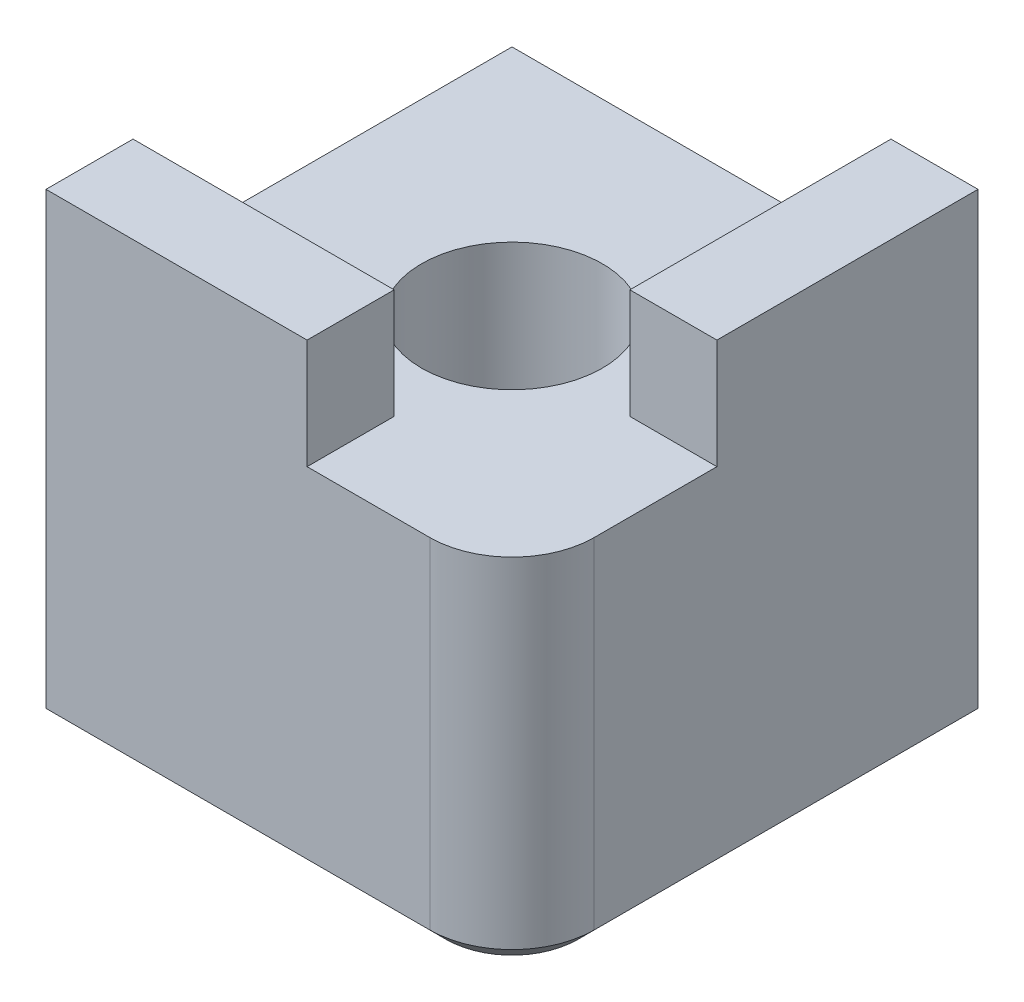
from build123d import *

# Parameters (mm, degrees)
BASE_W              = 8.5
BASE_H              = 8.5
BOSS_EXTRUDE1_DEPTH = 8
CUTOUT_W            = 7
CUTOUT_H            = 7
CUT_EXTRUDE1_DEPTH  = 1.5
SKETCH3_W           = 1.5
SKETCH3_H           = 1.5
CUT_EXTRUDE2_DEPTH  = 12.448253142
FILLET3_R           = 0.508
FILLET4_R           = 1.5
M4_TAPPED_HOLE1_D   = 3.3
CHAMFER1_SIZE       = 0.3
CUT_EXTRUDE3_START  = -1.5
CUT_EXTRUDE3_DEPTH  = 1.5
SKETCH16_W          = 1.5875
SKETCH16_H          = 4.7625
SKETCH16_W_2        = 4.7625
SKETCH16_H_2        = 1.5875
BOSS_EXTRUDE2_DEPTH = 2


with BuildPart() as part:
    # Base → Boss-Extrude1 (new body)
    with BuildSketch(Plane(origin=(0, 0, 0), x_dir=(1, 0, 0), z_dir=(0, 1, 0))):
        Rectangle(BASE_W, BASE_H)
    extrude(amount=-BOSS_EXTRUDE1_DEPTH)

    # Cutout → Cut-Extrude1 (cut)
    with BuildSketch(Plane(origin=(0, 0, 0), x_dir=(1, 0, 0), z_dir=(0, 1, 0))):
        with Locations((-0.75, 0.75)):
            Rectangle(CUTOUT_W, CUTOUT_H)
    extrude(amount=-CUT_EXTRUDE1_DEPTH, mode=Mode.SUBTRACT)

    # Sketch3 → Cut-Extrude2 (cut, through all)
    with BuildSketch(Plane.ZY.offset(-2.75)):
        with Locations((-3.5, -0.75)):
            Rectangle(SKETCH3_W, SKETCH3_H)
    cut_extrude2 = extrude(amount=-CUT_EXTRUDE2_DEPTH, mode=Mode.SUBTRACT)

    # Mirror1: Cut-Extrude2 across plane
    add(cut_extrude2.mirror(Plane(origin=(0, 0, 0), x_dir=(0.7071067811865476, 0, 0.7071067811865475), z_dir=(0.7071067811865475, 0, -0.7071067811865476))), mode=Mode.SUBTRACT)

    # Fillet3
    fillet3_edges = [part.edges().sort_by_distance(p)[0] for p in [
        (2.75, -0.75, 2.75),
    ]]
    fillet(fillet3_edges, radius=FILLET3_R)

    # Fillet4
    fillet4_edges = [part.edges().sort_by_distance(p)[0] for p in [
        (4.25, -4, 4.25),
    ]]
    fillet(fillet4_edges, radius=FILLET4_R)

    # M4 Tapped Hole1 (through all)
    with Locations(Plane(origin=(0, -1.5, 0), x_dir=(1, 0, 0), z_dir=(0, 1, 0))):
        with Locations((0, 0)):
            Hole(M4_TAPPED_HOLE1_D / 2)

    # Chamfer1
    chamfer1_edges = [part.edges().sort_by_distance(p)[0] for p in [
        (-4.25, -8, 0),
        (-0.75, -8, 4.25),
        (4.25, -8, -0.75),
        (3.810660172, -8, 3.810660172),
        (0, -8, -4.25),
    ]]
    chamfer(chamfer1_edges, length=CHAMFER1_SIZE)

    # Sketch14 → Cut-Extrude3 (cut)
    with BuildSketch(Plane(origin=(0, 0, 0), x_dir=(1, 0, 0), z_dir=(0, 1, 0)).offset(CUT_EXTRUDE3_START)):
        with BuildLine():
            Line((-2.75, -4.25), (2.75, -4.25))
            ThreePointArc((2.75, -4.25), (3.810660172, -3.810660172), (4.25, -2.75))
            Line((4.25, -2.75), (4.25, 2.75))
            Line((4.25, 2.75), (2.75, 2.75))
            Line((2.75, 2.75), (2.75, -2.242))
            ThreePointArc((2.75, -2.242), (2.601210245, -2.601210245), (2.242, -2.75))
            Line((2.242, -2.75), (-2.75, -2.75))
            Line((-2.75, -2.75), (-2.75, -4.25))
        make_face()
    extrude(amount=CUT_EXTRUDE3_DEPTH, mode=Mode.SUBTRACT)

    # Sketch16 → Boss-Extrude2 (add)
    with BuildSketch(Plane(origin=(0, -1.5, 0), x_dir=(1, 0, 0), z_dir=(0, 1, 0))):
        with Locations((3.45625, 1.86875)):
            Rectangle(SKETCH16_W, SKETCH16_H)
        with Locations((-1.86875, -3.45625)):
            Rectangle(SKETCH16_W_2, SKETCH16_H_2)
    extrude(amount=BOSS_EXTRUDE2_DEPTH)


solid = part.part
